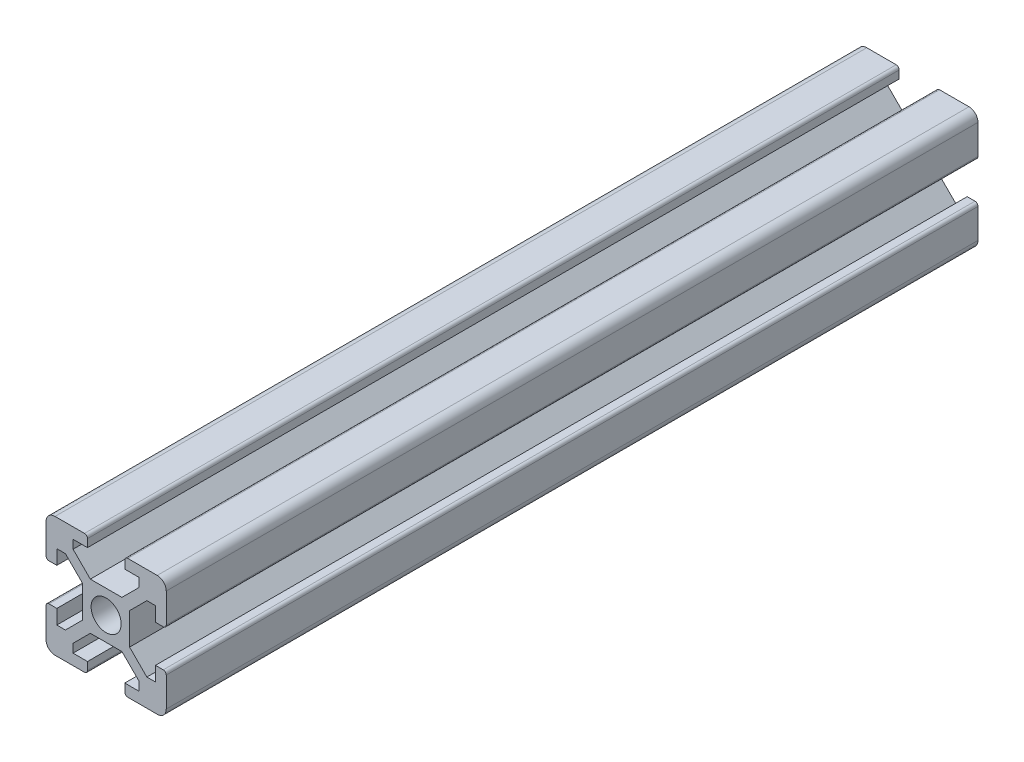
from build123d import *

# Parameters (mm, degrees)
SKETCH_1_R      = 2.5
EXTRUDE_1_DEPTH = 135
FILLET_1_R      = 1.5
FILLET_2_R      = 1.5
FILLET_3_R      = 1.5
FILLET_4_R      = 1.5
FILLET_5_R      = 0.5
FILLET_6_R      = 0.5
FILLET_7_R      = 0.5
FILLET_8_R      = 0.5
FILLET_9_R      = 0.5
FILLET_10_R     = 0.5
FILLET_11_R     = 0.5
FILLET_12_R     = 0.5


with BuildPart() as part:
    # 草图1 → 凸台-拉伸1 (new body)
    with BuildSketch(Plane.XY):
        Polygon((0, 6.9), (0, 0), (6.9, 0), (6.9, 1.8), (4.5, 1.8), (4.5, 3.227207794), (7.372792206, 6.1), (12.627207794, 6.1), (15.5, 3.227207794), (15.5, 1.8), (13.1, 1.8), (13.1, 0), (20, 0), (20, 6.9), (18.2, 6.9), (18.2, 4.5), (16.772792206, 4.5), (13.9, 7.372792206), (13.9, 12.627207794), (16.772792206, 15.5), (18.2, 15.5), (18.2, 13.1), (20, 13.1), (20, 20), (13.1, 20), (13.1, 18.2), (15.5, 18.2), (15.5, 16.772792206), (12.627207794, 13.9), (7.372792206, 13.9), (4.5, 16.772792206), (4.5, 18.2), (6.9, 18.2), (6.9, 20), (0, 20), (0, 13.1), (1.8, 13.1), (1.8, 15.5), (3.227207794, 15.5), (6.1, 12.627207794), (6.1, 7.372792206), (3.227207794, 4.5), (1.8, 4.5), (1.8, 6.9), align=None)
        with Locations((10, 10)):
            Circle(SKETCH_1_R, mode=Mode.SUBTRACT)
    extrude(amount=EXTRUDE_1_DEPTH)

    # 圆角1
    fillet_1_edges = [part.edges().sort_by_distance(p)[0] for p in [
        (20, 20, 67.5),
    ]]
    fillet(fillet_1_edges, radius=FILLET_1_R)

    # 圆角2
    fillet_2_edges = [part.edges().sort_by_distance(p)[0] for p in [
        (0, 20, 67.5),
    ]]
    fillet(fillet_2_edges, radius=FILLET_2_R)

    # 圆角3
    fillet_3_edges = [part.edges().sort_by_distance(p)[0] for p in [
        (0, 0, 67.5),
    ]]
    fillet(fillet_3_edges, radius=FILLET_3_R)

    # 圆角4
    fillet_4_edges = [part.edges().sort_by_distance(p)[0] for p in [
        (20, 0, 67.5),
    ]]
    fillet(fillet_4_edges, radius=FILLET_4_R)

    # 圆角5
    fillet_5_edges = [part.edges().sort_by_distance(p)[0] for p in [
        (13.1, 20, 67.5),
    ]]
    fillet(fillet_5_edges, radius=FILLET_5_R)

    # 圆角6
    fillet_6_edges = [part.edges().sort_by_distance(p)[0] for p in [
        (6.9, 20, 67.5),
    ]]
    fillet(fillet_6_edges, radius=FILLET_6_R)

    # 圆角7
    fillet_7_edges = [part.edges().sort_by_distance(p)[0] for p in [
        (0, 13.1, 67.5),
    ]]
    fillet(fillet_7_edges, radius=FILLET_7_R)

    # 圆角8
    fillet_8_edges = [part.edges().sort_by_distance(p)[0] for p in [
        (0, 6.9, 67.5),
    ]]
    fillet(fillet_8_edges, radius=FILLET_8_R)

    # 圆角9
    fillet_9_edges = [part.edges().sort_by_distance(p)[0] for p in [
        (6.9, 0, 67.5),
    ]]
    fillet(fillet_9_edges, radius=FILLET_9_R)

    # 圆角10
    fillet_10_edges = [part.edges().sort_by_distance(p)[0] for p in [
        (13.1, 0, 67.5),
    ]]
    fillet(fillet_10_edges, radius=FILLET_10_R)

    # 圆角11
    fillet_11_edges = [part.edges().sort_by_distance(p)[0] for p in [
        (20, 13.1, 67.5),
    ]]
    fillet(fillet_11_edges, radius=FILLET_11_R)

    # 圆角12
    fillet_12_edges = [part.edges().sort_by_distance(p)[0] for p in [
        (20, 6.9, 67.5),
    ]]
    fillet(fillet_12_edges, radius=FILLET_12_R)


solid = part.part
